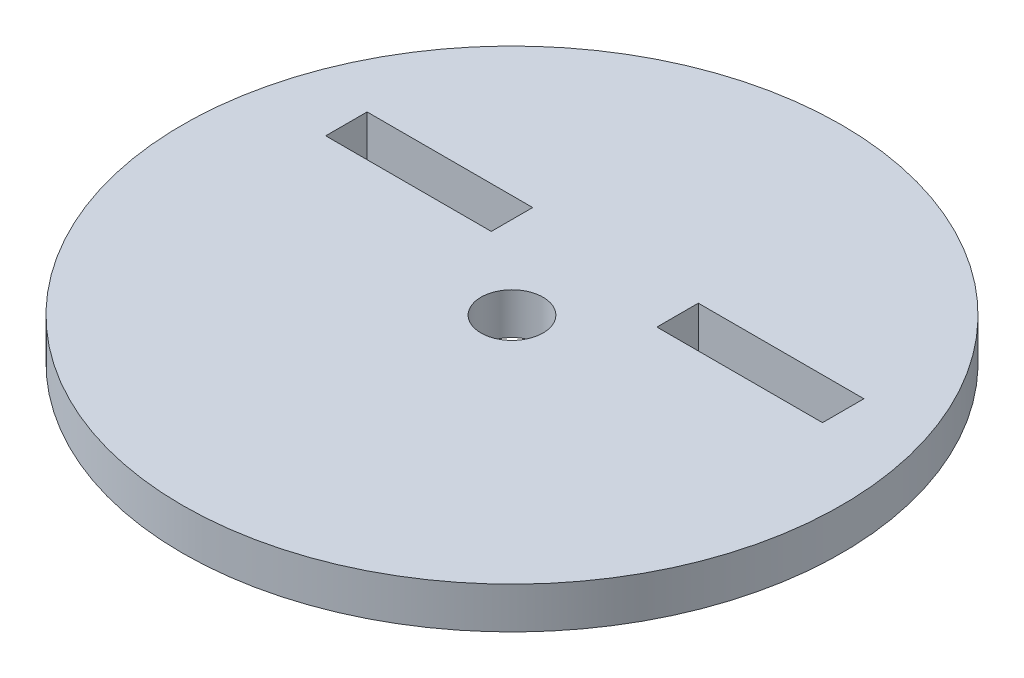
from build123d import *

# Parameters (mm, degrees)
SKETCH1_R           = 50.546
SKETCH1_R_2         = 4.7625
SKETCH1_W           = 25.4
SKETCH1_H           = 6.35
BOSS_EXTRUDE1_DEPTH = 6.35


with BuildPart() as part:
    # Sketch1 → Boss-Extrude1 (new body)
    with BuildSketch(Plane(origin=(0, 0, 0), x_dir=(1, 0, 0), z_dir=(0, 1, 0))):
        with Locations(Location((0, 0, 0), (0, 0, 270))):
            Circle(SKETCH1_R)
        with Locations(Location((0, 0, 0), (0, 0, 270))):
            Circle(SKETCH1_R_2, mode=Mode.SUBTRACT)
        with Locations((-25.4, 12.7)):
            Rectangle(SKETCH1_W, SKETCH1_H, mode=Mode.SUBTRACT)
        with Locations((25.4, 12.7)):
            Rectangle(SKETCH1_W, SKETCH1_H, mode=Mode.SUBTRACT)
    extrude(amount=BOSS_EXTRUDE1_DEPTH)


solid = part.part
